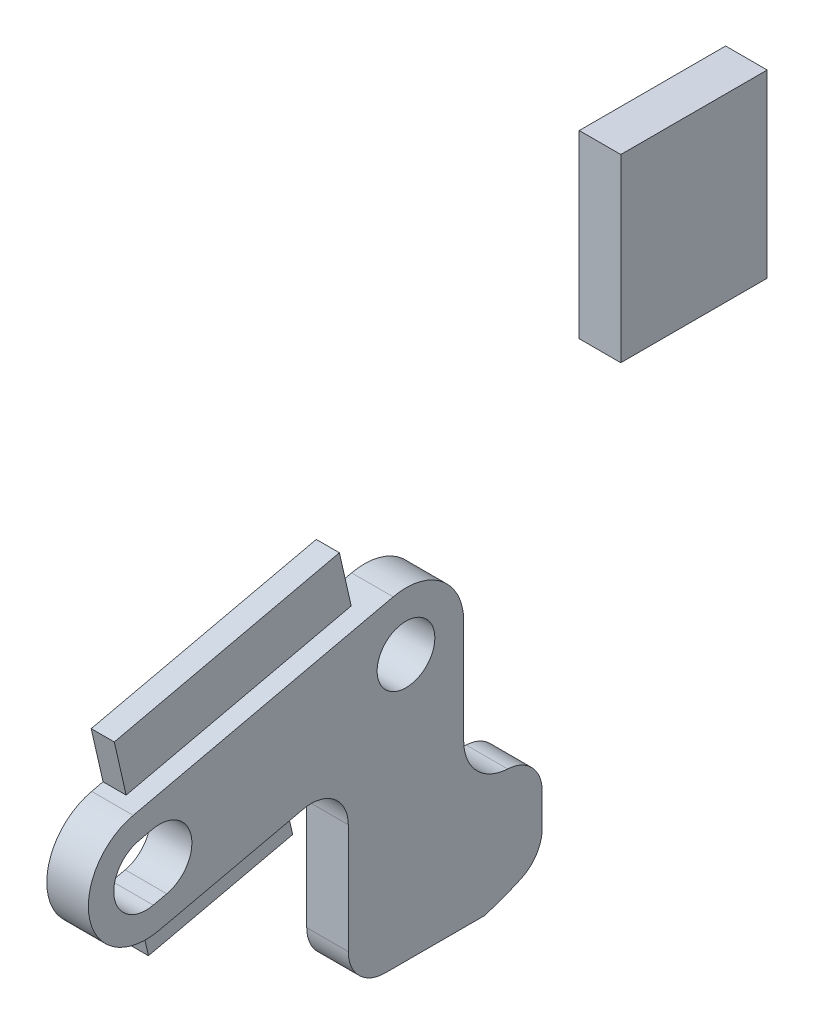
from build123d import *

# Parameters (mm, degrees)
SKETCH2_R           = 1.5875
BOSS_EXTRUDE1_DEPTH = 2.286
FILLET1_R           = 2.032
FILLET3_R           = 2.54
CUT_EXTRUDE2_DEPTH  = 38.538801483
FILLET4_R           = 2
FILLET5_R           = 2
BOSS_EXTRUDE2_DEPTH = 1.27
SKETCH6_W           = 8.053565913
SKETCH6_H           = 9.921059459
BOSS_EXTRUDE3_DEPTH = 2.286


with BuildPart() as part:
    # Sketch2 → Boss-Extrude1 (new body)
    with BuildSketch(Plane(origin=(0, 0, 0), x_dir=(0, 0, -1), z_dir=(1, 0, 0))):
        with BuildLine():
            Line((-19.322996014, 27.140905532), (-5.0236712, 30.400586076))
            ThreePointArc((-5.0236712, 30.400586076), (-2.338085994, 29.787048656), (-1.143, 27.305))
            Line((-1.143, 27.305), (-1.143, 19.05))
            Line((-1.143, 19.05), (3.175, 19.05))
            Line((3.175, 19.05), (3.175, 15.875))
            Line((3.175, 15.875), (3.175, 12.7))
            Line((3.175, 12.7), (-7.493, 12.7))
            Line((-7.493, 12.7), (-7.493, 23.324774364))
            Line((-7.493, 23.324774364), (-17.911653613, 20.949733379))
            ThreePointArc((-17.911653613, 20.949733379), (-21.71291089, 23.339648256), (-19.322996014, 27.140905532))
        make_face()
        with Locations((-4.318, 27.305)):
            Circle(SKETCH2_R, mode=Mode.SUBTRACT)
        with BuildLine():
            Line((-18.222148942, 22.311791253), (-17.479208283, 22.481152341))
            ThreePointArc((-17.479208283, 22.481152341), (-16.140855953, 24.609856416), (-18.269560028, 25.948208747))
            Line((-18.269560028, 25.948208747), (-19.012500686, 25.778847659))
            ThreePointArc((-19.012500686, 25.778847659), (-20.350853017, 23.650143584), (-18.222148942, 22.311791253))
        make_face(mode=Mode.SUBTRACT)
    extrude(amount=BOSS_EXTRUDE1_DEPTH)

    # Fillet1
    fillet1_edges = [part.edges().sort_by_distance(p)[0] for p in [
        (1.143, 12.7, 7.493),
        (1.143, 23.324774364, 7.493),
    ]]
    fillet(fillet1_edges, radius=FILLET1_R)

    # Fillet3
    fillet3_edges = [part.edges().sort_by_distance(p)[0] for p in [
        (1.143, 19.05, 1.143),
    ]]
    fillet(fillet3_edges, radius=FILLET3_R)

    # Sketch4 → Cut-Extrude2 (cut, through all)
    with BuildSketch(Plane(origin=(2.286, 0, 0), x_dir=(0, 0, -1), z_dir=(1, 0, 0))):
        with BuildLine():
            Line((3.175, 14.045810734), (3.175, 12.7))
            Line((3.175, 12.7), (0, 12.7))
            ThreePointArc((0, 12.7), (1.625713644, 13.282752779), (3.175, 14.045810734))
        make_face()
    extrude(amount=-CUT_EXTRUDE2_DEPTH, mode=Mode.SUBTRACT)

    # Fillet4
    fillet4_edges = [part.edges().sort_by_distance(p)[0] for p in [
        (1.143, 14.045810734, -3.175),
    ]]
    fillet(fillet4_edges, radius=FILLET4_R)

    # Fillet5
    fillet5_edges = [part.edges().sort_by_distance(p)[0] for p in [
        (1.143, 19.05, -3.175),
    ]]
    fillet(fillet5_edges, radius=FILLET5_R)

    # Sketch5 → Boss-Extrude2 (add)
    with BuildSketch(Plane.ZY):
        Polygon((6.315327521, 30.106139518), (18.697671827, 27.283454717), (19.349637641, 30.143449985), (6.967293335, 32.966134786), align=None)
        Polygon((9.976629568, 22.758605045), (17.911653613, 20.949733379), (17.470982606, 19.01663049), (9.53595856, 20.825502156), align=None)
    extrude(amount=-BOSS_EXTRUDE2_DEPTH)


with BuildPart() as body_2:
    # Sketch6 → Boss-Extrude3 (new body)
    with BuildSketch(Plane(origin=(2.286, 0, 0), x_dir=(0, 0, -1), z_dir=(1, 0, 0))):
        with Locations((11.525562457, 40.25328062)):
            Rectangle(SKETCH6_W, SKETCH6_H)
    extrude(amount=-BOSS_EXTRUDE3_DEPTH)


solid = Compound([part.part, body_2.part])
